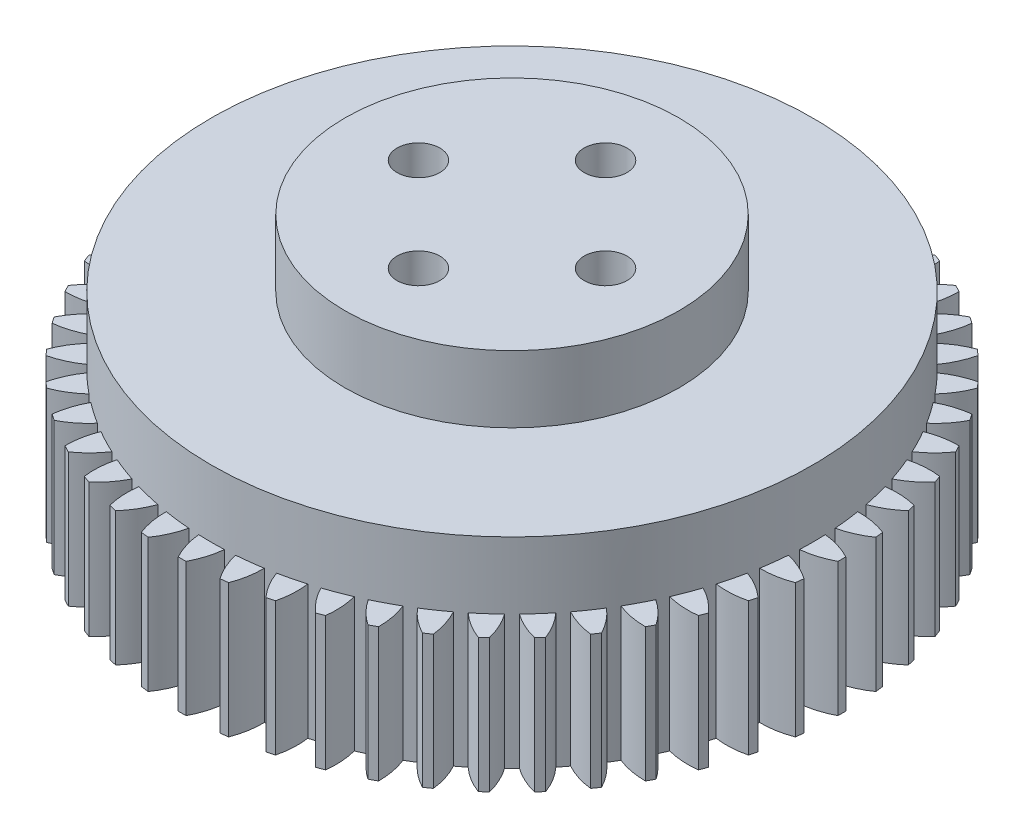
from build123d import *

# Parameters (mm, degrees)
SKETCH1_R           = 22.5
BOSS_EXTRUDE1_DEPTH = 15
SKETCH2_R           = 12.5
BOSS_EXTRUDE2_DEPTH = 5
SKETCH3_R           = 1.6
CUT_EXTRUDE2_DEPTH  = 21
SKETCH4_R           = 3
CUT_EXTRUDE3_DEPTH  = 4
BOSS_EXTRUDE3_DEPTH = 10
SKETCH7_R           = 4
BOSS_EXTRUDE5_DEPTH = 9
SKETCH8_R           = 0.8
CUT_EXTRUDE4_DEPTH  = 24


with BuildPart() as part:
    # Sketch1 → Boss-Extrude1 (new body)
    with BuildSketch(Plane(origin=(0, 0, 0), x_dir=(1, 0, 0), z_dir=(0, 1, 0))):
        with Locations(Location((0, 0, 0), (0, 0, 270))):
            Circle(SKETCH1_R)
    extrude(amount=BOSS_EXTRUDE1_DEPTH)

    # Sketch2 → Boss-Extrude2 (add)
    with BuildSketch(Plane(origin=(0, 15, 0), x_dir=(1, 0, 0), z_dir=(0, 1, 0))):
        with Locations(Location((0, 0, 0), (0, 0, 270))):
            Circle(SKETCH2_R)
    extrude(amount=BOSS_EXTRUDE2_DEPTH)

    # Sketch3 → Cut-Extrude2 (cut)
    with BuildSketch(Plane(origin=(0, 20, 0), x_dir=(1, 0, 0), z_dir=(0, 1, 0))):
        with Locations(Location((7, 0, 0), (0, 0, 270))):
            Circle(SKETCH3_R)
        with Locations(Location((0, -7, 0), (0, 0, 270))):
            Circle(SKETCH3_R)
        with Locations(Location((-7, 0, 0), (0, 0, 270))):
            Circle(SKETCH3_R)
        with Locations(Location((0, 7, 0), (0, 0, 270))):
            Circle(SKETCH3_R)
    extrude(amount=-CUT_EXTRUDE2_DEPTH, mode=Mode.SUBTRACT)

    # Sketch4 → Cut-Extrude3 (cut)
    with BuildSketch(Plane.XZ):
        with Locations(Location((0, -7, 0), (0, 0, 270))):
            Circle(SKETCH4_R)
        with Locations(Location((-7, 0, 0), (0, 0, 270))):
            Circle(SKETCH4_R)
        with Locations(Location((0, 7, 0), (0, 0, 270))):
            Circle(SKETCH4_R)
        with Locations(Location((7, 0, 0), (0, 0, 270))):
            Circle(SKETCH4_R)
    extrude(amount=-CUT_EXTRUDE3_DEPTH, mode=Mode.SUBTRACT)

    # Sketch5 → Boss-Extrude3 (add)
    with BuildSketch(Plane.XZ):
        with BuildLine():
            ThreePointArc((-0.292653692, 24.682759316), (-0.746983902, 23.575453202), (-0.972488982, 22.4))
            ThreePointArc((-0.972488982, 22.4), (0, 22.421100214), (0.972488982, 22.4))
            ThreePointArc((0.972488982, 22.4), (0.746983902, 23.575453202), (0.292653692, 24.682759316))
            ThreePointArc((0.292653692, 24.682759316), (0, 24.684494194), (-0.292653692, 24.682759316))
        make_face()
        with BuildLine():
            ThreePointArc((2.684657951, 24.538069714), (2.100169316, 23.493600564), (1.734623195, 22.353899373))
            ThreePointArc((1.734623195, 22.353899373), (2.702564988, 22.25762515), (3.66542008, 22.119458186))
            ThreePointArc((3.66542008, 22.119458186), (3.583244413, 23.313522645), (3.265697784, 24.467518706))
            ThreePointArc((3.265697784, 24.467518706), (2.975386984, 24.504516439), (2.684657951, 24.538069714))
        make_face()
        with BuildLine():
            ThreePointArc((5.622821235, 24.035559802), (4.916697336, 23.069158327), (4.416440661, 21.981828557))
            ThreePointArc((4.416440661, 21.981828557), (5.365720492, 21.769583791), (6.3049011, 21.516364864))
            ThreePointArc((6.3049011, 21.516364864), (6.367253152, 22.71162843), (6.191120649, 23.895486577))
            ThreePointArc((6.191120649, 23.895486577), (5.907386126, 23.967207655), (5.622821235, 24.035559802))
        make_face()
        with BuildLine():
            ThreePointArc((8.478991124, 23.182557304), (7.661528838, 22.308315815), (7.033856476, 21.289213182))
            ThreePointArc((7.033856476, 21.289213182), (7.950631709, 20.964092879), (8.852442464, 20.599514491))
            ThreePointArc((8.852442464, 20.599514491), (9.058413001, 21.77854753), (9.026263034, 22.975004445))
            ThreePointArc((9.026263034, 22.975004445), (8.753242275, 23.080403014), (8.478991124, 23.182557304))
        make_face()
        with BuildLine():
            ThreePointArc((11.211518229, 21.991500918), (10.294637997, 21.222167824), (9.548702825, 20.286153139))
            ThreePointArc((9.548702825, 20.286153139), (10.419604812, 19.852898287), (11.270895283, 19.38227681))
            ThreePointArc((11.270895283, 19.38227681), (11.617480792, 20.527886366), (11.729782179, 21.719495014))
            ThreePointArc((11.729782179, 21.719495014), (11.471456442, 21.857034124), (11.211518229, 21.991500918))
        make_face()
        with BuildLine():
            ThreePointArc((13.780556153, 20.479758928), (12.777628152, 19.826552838), (11.924307585, 18.987275303))
            ThreePointArc((11.924307585, 18.987275303), (12.736636615, 18.452203732), (13.524993069, 17.882401889))
            ThreePointArc((13.524993069, 17.882401889), (14.007139552, 18.977882395), (14.262254686, 20.147266437))
            ThreePointArc((14.262254686, 20.147266437), (14.022390943, 20.31494046), (13.780556153, 20.479758928))
        make_face()
        with BuildLine():
            ThreePointArc((16.148642537, 18.669375936), (15.074291717, 18.141822066), (14.126029089, 17.411520238))
            ThreePointArc((14.126029089, 17.411520238), (14.867939575, 16.782434496), (15.581866, 16.12176128))
            ThreePointArc((15.581866, 16.12176128), (16.192542676, 17.151138163), (16.586751404, 18.281245348))
            ThreePointArc((16.586751404, 18.281245348), (16.368847407, 18.476609218), (16.148642537, 18.669375936))
        make_face()
        with BuildLine():
            ThreePointArc((18.281245348, 16.586751404), (17.151138163, 16.192542676), (16.12176128, 15.581866))
            ThreePointArc((16.12176128, 15.581866), (16.782434496, 14.867939575), (17.411520238, 14.126029089))
            ThreePointArc((17.411520238, 14.126029089), (18.141822066, 15.074291717), (18.669375936, 16.148642537))
            ThreePointArc((18.669375936, 16.148642537), (18.476609218, 16.368847407), (18.281245348, 16.586751404))
        make_face()
        with BuildLine():
            ThreePointArc((20.147266437, 14.262254686), (18.977882395, 14.007139552), (17.882401889, 13.524993069))
            ThreePointArc((17.882401889, 13.524993069), (18.452203732, 12.736636615), (18.987275303, 11.924307585))
            ThreePointArc((18.987275303, 11.924307585), (19.826552838, 12.777628152), (20.479758928, 13.780556153))
            ThreePointArc((20.479758928, 13.780556153), (20.31494046, 14.022390943), (20.147266437, 14.262254686))
        make_face()
        with BuildLine():
            ThreePointArc((21.719495014, 11.729782179), (20.527886366, 11.617480792), (19.38227681, 11.270895283))
            ThreePointArc((19.38227681, 11.270895283), (19.852898287, 10.419604812), (20.286153139, 9.548702825))
            ThreePointArc((20.286153139, 9.548702825), (21.222167824, 10.294637997), (21.991500918, 11.211518229))
            ThreePointArc((21.991500918, 11.211518229), (21.857034124, 11.471456442), (21.719495014, 11.729782179))
        make_face()
        with BuildLine():
            ThreePointArc((22.975004445, 9.026263034), (21.77854753, 9.058413001), (20.599514491, 8.852442464))
            ThreePointArc((20.599514491, 8.852442464), (20.964092879, 7.950631709), (21.289213182, 7.033856476))
            ThreePointArc((21.289213182, 7.033856476), (22.308315815, 7.661528838), (23.182557304, 8.478991124))
            ThreePointArc((23.182557304, 8.478991124), (23.080403014, 8.753242275), (22.975004445, 9.026263034))
        make_face()
        with BuildLine():
            ThreePointArc((23.895486577, 6.191120649), (22.71162843, 6.367253152), (21.516364864, 6.3049011))
            ThreePointArc((21.516364864, 6.3049011), (21.769583791, 5.365720492), (21.981828557, 4.416440661))
            ThreePointArc((21.981828557, 4.416440661), (23.069158327, 4.916697336), (24.035559802, 5.622821235))
            ThreePointArc((24.035559802, 5.622821235), (23.967207655, 5.907386126), (23.895486577, 6.191120649))
        make_face()
        with BuildLine():
            ThreePointArc((24.467518706, 3.265697784), (23.313522645, 3.583244413), (22.119458186, 3.66542008))
            ThreePointArc((22.119458186, 3.66542008), (22.25762515, 2.702564988), (22.353899373, 1.734623195))
            ThreePointArc((22.353899373, 1.734623195), (23.493600564, 2.100169316), (24.538069714, 2.684657951))
            ThreePointArc((24.538069714, 2.684657951), (24.504516439, 2.975386984), (24.467518706, 3.265697784))
        make_face()
        with BuildLine():
            ThreePointArc((24.682759316, 0.292653692), (23.575453202, 0.746983902), (22.4, 0.972488982))
            ThreePointArc((22.4, 0.972488982), (22.421100214, 0), (22.4, -0.972488982))
            ThreePointArc((22.4, -0.972488982), (23.575453202, -0.746983902), (24.682759316, -0.292653692))
            ThreePointArc((24.682759316, -0.292653692), (24.684494194, 0), (24.682759316, 0.292653692))
        make_face()
        with BuildLine():
            ThreePointArc((24.538069714, -2.684657951), (23.493600564, -2.100169316), (22.353899373, -1.734623195))
            ThreePointArc((22.353899373, -1.734623195), (22.25762515, -2.702564988), (22.119458186, -3.66542008))
            ThreePointArc((22.119458186, -3.66542008), (23.313522645, -3.583244413), (24.467518706, -3.265697784))
            ThreePointArc((24.467518706, -3.265697784), (24.504516439, -2.975386984), (24.538069714, -2.684657951))
        make_face()
        with BuildLine():
            ThreePointArc((24.035559802, -5.622821235), (23.069158327, -4.916697336), (21.981828557, -4.416440661))
            ThreePointArc((21.981828557, -4.416440661), (21.769583791, -5.365720492), (21.516364864, -6.3049011))
            ThreePointArc((21.516364864, -6.3049011), (22.71162843, -6.367253152), (23.895486577, -6.191120649))
            ThreePointArc((23.895486577, -6.191120649), (23.967207655, -5.907386126), (24.035559802, -5.622821235))
        make_face()
        with BuildLine():
            ThreePointArc((23.182557304, -8.478991124), (22.308315815, -7.661528838), (21.289213182, -7.033856476))
            ThreePointArc((21.289213182, -7.033856476), (20.964092879, -7.950631709), (20.599514491, -8.852442464))
            ThreePointArc((20.599514491, -8.852442464), (21.77854753, -9.058413001), (22.975004445, -9.026263034))
            ThreePointArc((22.975004445, -9.026263034), (23.080403014, -8.753242275), (23.182557304, -8.478991124))
        make_face()
        with BuildLine():
            ThreePointArc((21.991500918, -11.211518229), (21.222167824, -10.294637997), (20.286153139, -9.548702825))
            ThreePointArc((20.286153139, -9.548702825), (19.852898287, -10.419604812), (19.38227681, -11.270895283))
            ThreePointArc((19.38227681, -11.270895283), (20.527886366, -11.617480792), (21.719495014, -11.729782179))
            ThreePointArc((21.719495014, -11.729782179), (21.857034124, -11.471456442), (21.991500918, -11.211518229))
        make_face()
        with BuildLine():
            ThreePointArc((20.479758928, -13.780556153), (19.826552838, -12.777628152), (18.987275303, -11.924307585))
            ThreePointArc((18.987275303, -11.924307585), (18.452203732, -12.736636615), (17.882401889, -13.524993069))
            ThreePointArc((17.882401889, -13.524993069), (18.977882395, -14.007139552), (20.147266437, -14.262254686))
            ThreePointArc((20.147266437, -14.262254686), (20.31494046, -14.022390943), (20.479758928, -13.780556153))
        make_face()
        with BuildLine():
            ThreePointArc((18.669375936, -16.148642537), (18.141822066, -15.074291717), (17.411520238, -14.126029089))
            ThreePointArc((17.411520238, -14.126029089), (16.782434496, -14.867939575), (16.12176128, -15.581866))
            ThreePointArc((16.12176128, -15.581866), (17.151138163, -16.192542676), (18.281245348, -16.586751404))
            ThreePointArc((18.281245348, -16.586751404), (18.476609218, -16.368847407), (18.669375936, -16.148642537))
        make_face()
        with BuildLine():
            ThreePointArc((16.586751404, -18.281245348), (16.192542676, -17.151138163), (15.581866, -16.12176128))
            ThreePointArc((15.581866, -16.12176128), (14.867939575, -16.782434496), (14.126029089, -17.411520238))
            ThreePointArc((14.126029089, -17.411520238), (15.074291717, -18.141822066), (16.148642537, -18.669375936))
            ThreePointArc((16.148642537, -18.669375936), (16.368847407, -18.476609218), (16.586751404, -18.281245348))
        make_face()
        with BuildLine():
            ThreePointArc((14.262254686, -20.147266437), (14.007139552, -18.977882395), (13.524993069, -17.882401889))
            ThreePointArc((13.524993069, -17.882401889), (12.736636615, -18.452203732), (11.924307585, -18.987275303))
            ThreePointArc((11.924307585, -18.987275303), (12.777628152, -19.826552838), (13.780556153, -20.479758928))
            ThreePointArc((13.780556153, -20.479758928), (14.022390943, -20.31494046), (14.262254686, -20.147266437))
        make_face()
        with BuildLine():
            ThreePointArc((11.729782179, -21.719495014), (11.617480792, -20.527886366), (11.270895283, -19.38227681))
            ThreePointArc((11.270895283, -19.38227681), (10.419604812, -19.852898287), (9.548702825, -20.286153139))
            ThreePointArc((9.548702825, -20.286153139), (10.294637997, -21.222167824), (11.211518229, -21.991500918))
            ThreePointArc((11.211518229, -21.991500918), (11.471456442, -21.857034124), (11.729782179, -21.719495014))
        make_face()
        with BuildLine():
            ThreePointArc((9.026263034, -22.975004445), (9.058413001, -21.77854753), (8.852442464, -20.599514491))
            ThreePointArc((8.852442464, -20.599514491), (7.950631709, -20.964092879), (7.033856476, -21.289213182))
            ThreePointArc((7.033856476, -21.289213182), (7.661528838, -22.308315815), (8.478991124, -23.182557304))
            ThreePointArc((8.478991124, -23.182557304), (8.753242275, -23.080403014), (9.026263034, -22.975004445))
        make_face()
        with BuildLine():
            ThreePointArc((6.191120649, -23.895486577), (6.367253152, -22.71162843), (6.3049011, -21.516364864))
            ThreePointArc((6.3049011, -21.516364864), (5.365720492, -21.769583791), (4.416440661, -21.981828557))
            ThreePointArc((4.416440661, -21.981828557), (4.916697336, -23.069158327), (5.622821235, -24.035559802))
            ThreePointArc((5.622821235, -24.035559802), (5.907386126, -23.967207655), (6.191120649, -23.895486577))
        make_face()
        with BuildLine():
            ThreePointArc((3.265697784, -24.467518706), (3.583244413, -23.313522645), (3.66542008, -22.119458186))
            ThreePointArc((3.66542008, -22.119458186), (2.702564988, -22.25762515), (1.734623195, -22.353899373))
            ThreePointArc((1.734623195, -22.353899373), (2.100169316, -23.493600564), (2.684657951, -24.538069714))
            ThreePointArc((2.684657951, -24.538069714), (2.975386984, -24.504516439), (3.265697784, -24.467518706))
        make_face()
        with BuildLine():
            ThreePointArc((0.292653692, -24.682759316), (0.746983902, -23.575453202), (0.972488982, -22.4))
            ThreePointArc((0.972488982, -22.4), (0, -22.421100214), (-0.972488982, -22.4))
            ThreePointArc((-0.972488982, -22.4), (-0.746983902, -23.575453202), (-0.292653692, -24.682759316))
            ThreePointArc((-0.292653692, -24.682759316), (0, -24.684494194), (0.292653692, -24.682759316))
        make_face()
        with BuildLine():
            ThreePointArc((-2.684657951, -24.538069714), (-2.100169316, -23.493600564), (-1.734623195, -22.353899373))
            ThreePointArc((-1.734623195, -22.353899373), (-2.702564988, -22.25762515), (-3.66542008, -22.119458186))
            ThreePointArc((-3.66542008, -22.119458186), (-3.583244413, -23.313522645), (-3.265697784, -24.467518706))
            ThreePointArc((-3.265697784, -24.467518706), (-2.975386984, -24.504516439), (-2.684657951, -24.538069714))
        make_face()
        with BuildLine():
            ThreePointArc((-5.622821235, -24.035559802), (-4.916697336, -23.069158327), (-4.416440661, -21.981828557))
            ThreePointArc((-4.416440661, -21.981828557), (-5.365720492, -21.769583791), (-6.3049011, -21.516364864))
            ThreePointArc((-6.3049011, -21.516364864), (-6.367253152, -22.71162843), (-6.191120649, -23.895486577))
            ThreePointArc((-6.191120649, -23.895486577), (-5.907386126, -23.967207655), (-5.622821235, -24.035559802))
        make_face()
        with BuildLine():
            ThreePointArc((-8.478991124, -23.182557304), (-7.661528838, -22.308315815), (-7.033856476, -21.289213182))
            ThreePointArc((-7.033856476, -21.289213182), (-7.950631709, -20.964092879), (-8.852442464, -20.599514491))
            ThreePointArc((-8.852442464, -20.599514491), (-9.058413001, -21.77854753), (-9.026263034, -22.975004445))
            ThreePointArc((-9.026263034, -22.975004445), (-8.753242275, -23.080403014), (-8.478991124, -23.182557304))
        make_face()
        with BuildLine():
            ThreePointArc((-11.211518229, -21.991500918), (-10.294637997, -21.222167824), (-9.548702825, -20.286153139))
            ThreePointArc((-9.548702825, -20.286153139), (-10.419604812, -19.852898287), (-11.270895283, -19.38227681))
            ThreePointArc((-11.270895283, -19.38227681), (-11.617480792, -20.527886366), (-11.729782179, -21.719495014))
            ThreePointArc((-11.729782179, -21.719495014), (-11.471456442, -21.857034124), (-11.211518229, -21.991500918))
        make_face()
        with BuildLine():
            ThreePointArc((-13.780556153, -20.479758928), (-12.777628152, -19.826552838), (-11.924307585, -18.987275303))
            ThreePointArc((-11.924307585, -18.987275303), (-12.736636615, -18.452203732), (-13.524993069, -17.882401889))
            ThreePointArc((-13.524993069, -17.882401889), (-14.007139552, -18.977882395), (-14.262254686, -20.147266437))
            ThreePointArc((-14.262254686, -20.147266437), (-14.022390943, -20.31494046), (-13.780556153, -20.479758928))
        make_face()
        with BuildLine():
            ThreePointArc((-16.148642537, -18.669375936), (-15.074291717, -18.141822066), (-14.126029089, -17.411520238))
            ThreePointArc((-14.126029089, -17.411520238), (-14.867939575, -16.782434496), (-15.581866, -16.12176128))
            ThreePointArc((-15.581866, -16.12176128), (-16.192542676, -17.151138163), (-16.586751404, -18.281245348))
            ThreePointArc((-16.586751404, -18.281245348), (-16.368847407, -18.476609218), (-16.148642537, -18.669375936))
        make_face()
        with BuildLine():
            ThreePointArc((-18.281245348, -16.586751404), (-17.151138163, -16.192542676), (-16.12176128, -15.581866))
            ThreePointArc((-16.12176128, -15.581866), (-16.782434496, -14.867939575), (-17.411520238, -14.126029089))
            ThreePointArc((-17.411520238, -14.126029089), (-18.141822066, -15.074291717), (-18.669375936, -16.148642537))
            ThreePointArc((-18.669375936, -16.148642537), (-18.476609218, -16.368847407), (-18.281245348, -16.586751404))
        make_face()
        with BuildLine():
            ThreePointArc((-20.147266437, -14.262254686), (-18.977882395, -14.007139552), (-17.882401889, -13.524993069))
            ThreePointArc((-17.882401889, -13.524993069), (-18.452203732, -12.736636615), (-18.987275303, -11.924307585))
            ThreePointArc((-18.987275303, -11.924307585), (-19.826552838, -12.777628152), (-20.479758928, -13.780556153))
            ThreePointArc((-20.479758928, -13.780556153), (-20.31494046, -14.022390943), (-20.147266437, -14.262254686))
        make_face()
        with BuildLine():
            ThreePointArc((-21.719495014, -11.729782179), (-20.527886366, -11.617480792), (-19.38227681, -11.270895283))
            ThreePointArc((-19.38227681, -11.270895283), (-19.852898287, -10.419604812), (-20.286153139, -9.548702825))
            ThreePointArc((-20.286153139, -9.548702825), (-21.222167824, -10.294637997), (-21.991500918, -11.211518229))
            ThreePointArc((-21.991500918, -11.211518229), (-21.857034124, -11.471456442), (-21.719495014, -11.729782179))
        make_face()
        with BuildLine():
            ThreePointArc((-22.975004445, -9.026263034), (-21.77854753, -9.058413001), (-20.599514491, -8.852442464))
            ThreePointArc((-20.599514491, -8.852442464), (-20.964092879, -7.950631709), (-21.289213182, -7.033856476))
            ThreePointArc((-21.289213182, -7.033856476), (-22.308315815, -7.661528838), (-23.182557304, -8.478991124))
            ThreePointArc((-23.182557304, -8.478991124), (-23.080403014, -8.753242275), (-22.975004445, -9.026263034))
        make_face()
        with BuildLine():
            ThreePointArc((-23.895486577, -6.191120649), (-22.71162843, -6.367253152), (-21.516364864, -6.3049011))
            ThreePointArc((-21.516364864, -6.3049011), (-21.769583791, -5.365720492), (-21.981828557, -4.416440661))
            ThreePointArc((-21.981828557, -4.416440661), (-23.069158327, -4.916697336), (-24.035559802, -5.622821235))
            ThreePointArc((-24.035559802, -5.622821235), (-23.967207655, -5.907386126), (-23.895486577, -6.191120649))
        make_face()
        with BuildLine():
            ThreePointArc((-24.467518706, -3.265697784), (-23.313522645, -3.583244413), (-22.119458186, -3.66542008))
            ThreePointArc((-22.119458186, -3.66542008), (-22.25762515, -2.702564988), (-22.353899373, -1.734623195))
            ThreePointArc((-22.353899373, -1.734623195), (-23.493600564, -2.100169316), (-24.538069714, -2.684657951))
            ThreePointArc((-24.538069714, -2.684657951), (-24.504516439, -2.975386984), (-24.467518706, -3.265697784))
        make_face()
        with BuildLine():
            ThreePointArc((-24.682759316, -0.292653692), (-23.575453202, -0.746983902), (-22.4, -0.972488982))
            ThreePointArc((-22.4, -0.972488982), (-22.421100214, 0), (-22.4, 0.972488982))
            ThreePointArc((-22.4, 0.972488982), (-23.575453202, 0.746983902), (-24.682759316, 0.292653692))
            ThreePointArc((-24.682759316, 0.292653692), (-24.684494194, 0), (-24.682759316, -0.292653692))
        make_face()
        with BuildLine():
            ThreePointArc((-24.538069714, 2.684657951), (-23.493600564, 2.100169316), (-22.353899373, 1.734623195))
            ThreePointArc((-22.353899373, 1.734623195), (-22.25762515, 2.702564988), (-22.119458186, 3.66542008))
            ThreePointArc((-22.119458186, 3.66542008), (-23.313522645, 3.583244413), (-24.467518706, 3.265697784))
            ThreePointArc((-24.467518706, 3.265697784), (-24.504516439, 2.975386984), (-24.538069714, 2.684657951))
        make_face()
        with BuildLine():
            ThreePointArc((-24.035559802, 5.622821235), (-23.069158327, 4.916697336), (-21.981828557, 4.416440661))
            ThreePointArc((-21.981828557, 4.416440661), (-21.769583791, 5.365720492), (-21.516364864, 6.3049011))
            ThreePointArc((-21.516364864, 6.3049011), (-22.71162843, 6.367253152), (-23.895486577, 6.191120649))
            ThreePointArc((-23.895486577, 6.191120649), (-23.967207655, 5.907386126), (-24.035559802, 5.622821235))
        make_face()
        with BuildLine():
            ThreePointArc((-23.182557304, 8.478991124), (-22.308315815, 7.661528838), (-21.289213182, 7.033856476))
            ThreePointArc((-21.289213182, 7.033856476), (-20.964092879, 7.950631709), (-20.599514491, 8.852442464))
            ThreePointArc((-20.599514491, 8.852442464), (-21.77854753, 9.058413001), (-22.975004445, 9.026263034))
            ThreePointArc((-22.975004445, 9.026263034), (-23.080403014, 8.753242275), (-23.182557304, 8.478991124))
        make_face()
        with BuildLine():
            ThreePointArc((-21.991500918, 11.211518229), (-21.222167824, 10.294637997), (-20.286153139, 9.548702825))
            ThreePointArc((-20.286153139, 9.548702825), (-19.852898287, 10.419604812), (-19.38227681, 11.270895283))
            ThreePointArc((-19.38227681, 11.270895283), (-20.527886366, 11.617480792), (-21.719495014, 11.729782179))
            ThreePointArc((-21.719495014, 11.729782179), (-21.857034124, 11.471456442), (-21.991500918, 11.211518229))
        make_face()
        with BuildLine():
            ThreePointArc((-20.479758928, 13.780556153), (-19.826552838, 12.777628152), (-18.987275303, 11.924307585))
            ThreePointArc((-18.987275303, 11.924307585), (-18.452203732, 12.736636615), (-17.882401889, 13.524993069))
            ThreePointArc((-17.882401889, 13.524993069), (-18.977882395, 14.007139552), (-20.147266437, 14.262254686))
            ThreePointArc((-20.147266437, 14.262254686), (-20.31494046, 14.022390943), (-20.479758928, 13.780556153))
        make_face()
        with BuildLine():
            ThreePointArc((-18.669375936, 16.148642537), (-18.141822066, 15.074291717), (-17.411520238, 14.126029089))
            ThreePointArc((-17.411520238, 14.126029089), (-16.782434496, 14.867939575), (-16.12176128, 15.581866))
            ThreePointArc((-16.12176128, 15.581866), (-17.151138163, 16.192542676), (-18.281245348, 16.586751404))
            ThreePointArc((-18.281245348, 16.586751404), (-18.476609218, 16.368847407), (-18.669375936, 16.148642537))
        make_face()
        with BuildLine():
            ThreePointArc((-16.586751404, 18.281245348), (-16.192542676, 17.151138163), (-15.581866, 16.12176128))
            ThreePointArc((-15.581866, 16.12176128), (-14.867939575, 16.782434496), (-14.126029089, 17.411520238))
            ThreePointArc((-14.126029089, 17.411520238), (-15.074291717, 18.141822066), (-16.148642537, 18.669375936))
            ThreePointArc((-16.148642537, 18.669375936), (-16.368847407, 18.476609218), (-16.586751404, 18.281245348))
        make_face()
        with BuildLine():
            ThreePointArc((-14.262254686, 20.147266437), (-14.007139552, 18.977882395), (-13.524993069, 17.882401889))
            ThreePointArc((-13.524993069, 17.882401889), (-12.736636615, 18.452203732), (-11.924307585, 18.987275303))
            ThreePointArc((-11.924307585, 18.987275303), (-12.777628152, 19.826552838), (-13.780556153, 20.479758928))
            ThreePointArc((-13.780556153, 20.479758928), (-14.022390943, 20.31494046), (-14.262254686, 20.147266437))
        make_face()
        with BuildLine():
            ThreePointArc((-11.729782179, 21.719495014), (-11.617480792, 20.527886366), (-11.270895283, 19.38227681))
            ThreePointArc((-11.270895283, 19.38227681), (-10.419604812, 19.852898287), (-9.548702825, 20.286153139))
            ThreePointArc((-9.548702825, 20.286153139), (-10.294637997, 21.222167824), (-11.211518229, 21.991500918))
            ThreePointArc((-11.211518229, 21.991500918), (-11.471456442, 21.857034124), (-11.729782179, 21.719495014))
        make_face()
        with BuildLine():
            ThreePointArc((-9.026263034, 22.975004445), (-9.058413001, 21.77854753), (-8.852442464, 20.599514491))
            ThreePointArc((-8.852442464, 20.599514491), (-7.950631709, 20.964092879), (-7.033856476, 21.289213182))
            ThreePointArc((-7.033856476, 21.289213182), (-7.661528838, 22.308315815), (-8.478991124, 23.182557304))
            ThreePointArc((-8.478991124, 23.182557304), (-8.753242275, 23.080403014), (-9.026263034, 22.975004445))
        make_face()
        with BuildLine():
            ThreePointArc((-6.191120649, 23.895486577), (-6.367253152, 22.71162843), (-6.3049011, 21.516364864))
            ThreePointArc((-6.3049011, 21.516364864), (-5.365720492, 21.769583791), (-4.416440661, 21.981828557))
            ThreePointArc((-4.416440661, 21.981828557), (-4.916697336, 23.069158327), (-5.622821235, 24.035559802))
            ThreePointArc((-5.622821235, 24.035559802), (-5.907386126, 23.967207655), (-6.191120649, 23.895486577))
        make_face()
        with BuildLine():
            ThreePointArc((-3.265697784, 24.467518706), (-3.583244413, 23.313522645), (-3.66542008, 22.119458186))
            ThreePointArc((-3.66542008, 22.119458186), (-2.702564988, 22.25762515), (-1.734623195, 22.353899373))
            ThreePointArc((-1.734623195, 22.353899373), (-2.100169316, 23.493600564), (-2.684657951, 24.538069714))
            ThreePointArc((-2.684657951, 24.538069714), (-2.975386984, 24.504516439), (-3.265697784, 24.467518706))
        make_face()
    extrude(amount=-BOSS_EXTRUDE3_DEPTH)

    # Sketch7 → Boss-Extrude5 (add)
    with BuildSketch(Plane.XZ):
        with Locations(Location((0, 0, 0), (0, 0, 89.999734772))):
            Circle(SKETCH7_R)
    extrude(amount=BOSS_EXTRUDE5_DEPTH)

    # Sketch8 → Cut-Extrude4 (cut)
    with BuildSketch(Plane.XZ.offset(9)):
        with Locations(Location((0, 0, 0), (0, 0, 270))):
            Circle(SKETCH8_R)
    extrude(amount=-CUT_EXTRUDE4_DEPTH, mode=Mode.SUBTRACT)


solid = part.part
